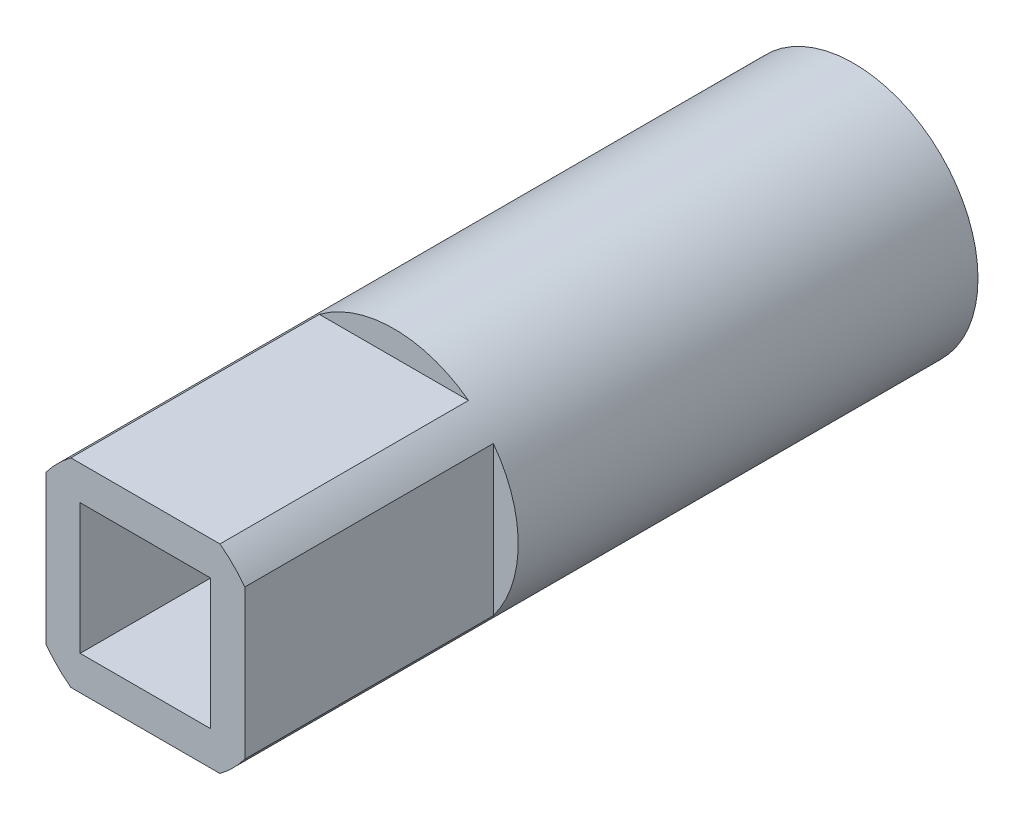
from build123d import *

# Parameters (mm, degrees)
SKETCH1_R           = 5
BOSS_EXTRUDE1_DEPTH = 18.5
BOSS_EXTRUDE2_DEPTH = 10
SKETCH4_W           = 5.25
SKETCH4_H           = 5.25
CUT_EXTRUDE2_DEPTH  = 10


with BuildPart() as part:
    # Sketch1 → Boss-Extrude1 (new body)
    with BuildSketch(Plane.XY):
        Circle(SKETCH1_R)
    extrude(amount=BOSS_EXTRUDE1_DEPTH)

    # Sketch3 → Boss-Extrude2 (add)
    with BuildSketch(Plane.XY.offset(18.5)):
        with BuildLine():
            ThreePointArc((-4, -3), (-3.535533906, -3.535533906), (-3, -4))
            Line((-3, -4), (3, -4))
            ThreePointArc((3, -4), (3.535533906, -3.535533906), (4, -3))
            Line((4, -3), (4, 3))
            ThreePointArc((4, 3), (3.535533906, 3.535533906), (3, 4))
            Line((3, 4), (-3, 4))
            ThreePointArc((-3, 4), (-3.535533906, 3.535533906), (-4, 3))
            Line((-4, 3), (-4, -3))
        make_face()
    extrude(amount=BOSS_EXTRUDE2_DEPTH)

    # Sketch4 → Cut-Extrude2 (cut)
    with BuildSketch(Plane.XY.offset(28.5)):
        Rectangle(SKETCH4_W, SKETCH4_H)
    extrude(amount=-CUT_EXTRUDE2_DEPTH, mode=Mode.SUBTRACT)


solid = part.part
